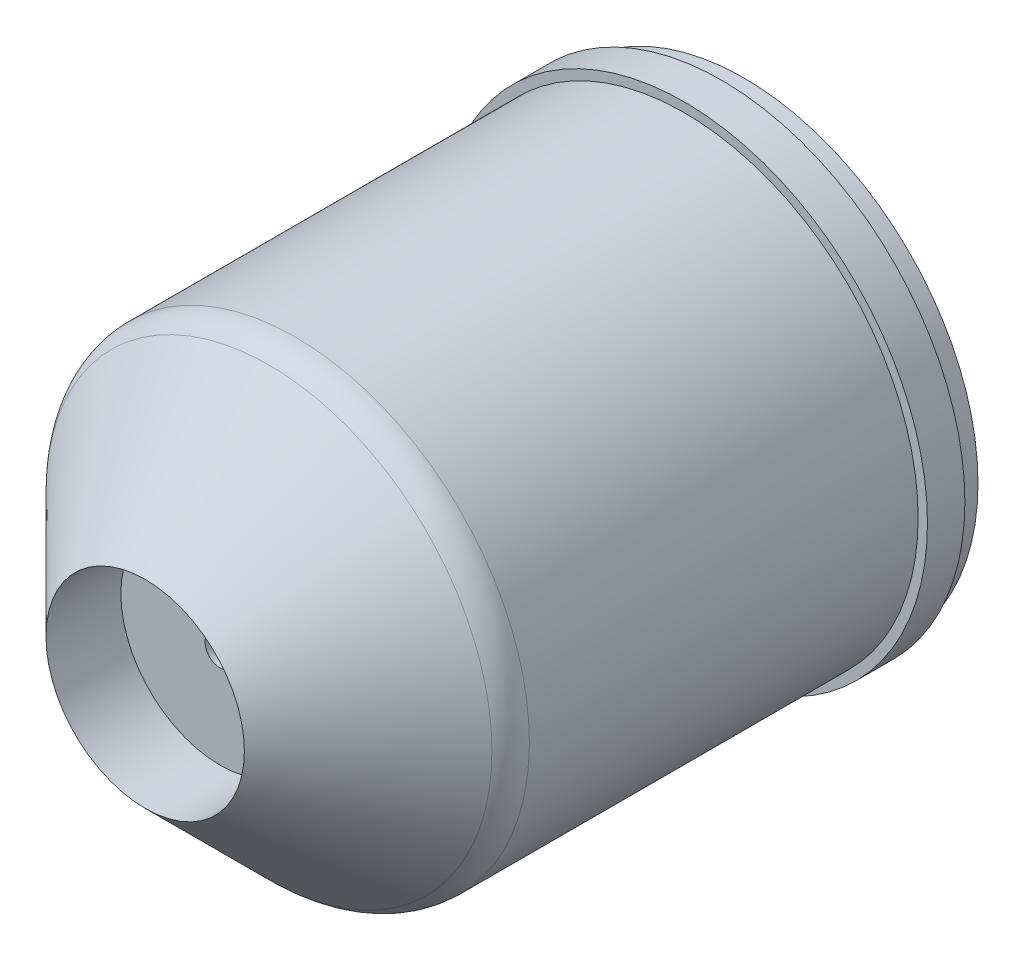
from build123d import *

# Parameters (mm, degrees)
SKETCH1_R           = 31.25
BOSS_EXTRUDE1_DEPTH = 80
SKETCH2_R           = 32.5
BOSS_EXTRUDE2_DEPTH = 5
CHAMFER1_SIZE       = 18
FILLET2_R           = 5
SKETCH6_R           = 13.25
CUT_EXTRUDE3_DEPTH  = 10
SKETCH7_R           = 28.75
CUT_EXTRUDE4_DEPTH  = 60
SKETCH8_R           = 2
SKETCH8_R_2         = 2.5
CUT_EXTRUDE5_DEPTH  = 84.740671122


with BuildPart() as part:
    # Sketch1 → Boss-Extrude1 (new body)
    with BuildSketch(Plane.XY):
        Circle(SKETCH1_R)
    extrude(amount=BOSS_EXTRUDE1_DEPTH)

    # Sketch2 → Boss-Extrude2 (add)
    with BuildSketch(Plane.XY.offset(3)):
        Circle(SKETCH2_R)
    extrude(amount=BOSS_EXTRUDE2_DEPTH)

    # Chamfer1
    chamfer1_edges = [part.edges().sort_by_distance(p)[0] for p in [
        (-31.25, 0, 80),
    ]]
    chamfer(chamfer1_edges, length=CHAMFER1_SIZE)

    # Fillet2
    fillet2_edges = [part.edges().sort_by_distance(p)[0] for p in [
        (-31.25, 0, 62),
    ]]
    fillet(fillet2_edges, radius=FILLET2_R)

    # Sketch6 → Cut-Extrude3 (cut)
    with BuildSketch(Plane.XY.offset(80)):
        Circle(SKETCH6_R)
    extrude(amount=-CUT_EXTRUDE3_DEPTH, mode=Mode.SUBTRACT)

    # Sketch7 → Cut-Extrude4 (cut)
    with BuildSketch(Plane(origin=(0, 0, 0), x_dir=(-1, 0, 0), z_dir=(0, 0, -1))):
        Circle(SKETCH7_R)
    extrude(amount=-CUT_EXTRUDE4_DEPTH, mode=Mode.SUBTRACT)

    # Sketch8 → Cut-Extrude5 (cut, through all)
    with BuildSketch(Plane.XY.offset(70)):
        Circle(SKETCH8_R)
        with Locations((8.096346775, 0)):
            Circle(SKETCH8_R_2)
    extrude(amount=-CUT_EXTRUDE5_DEPTH, mode=Mode.SUBTRACT)


solid = part.part
